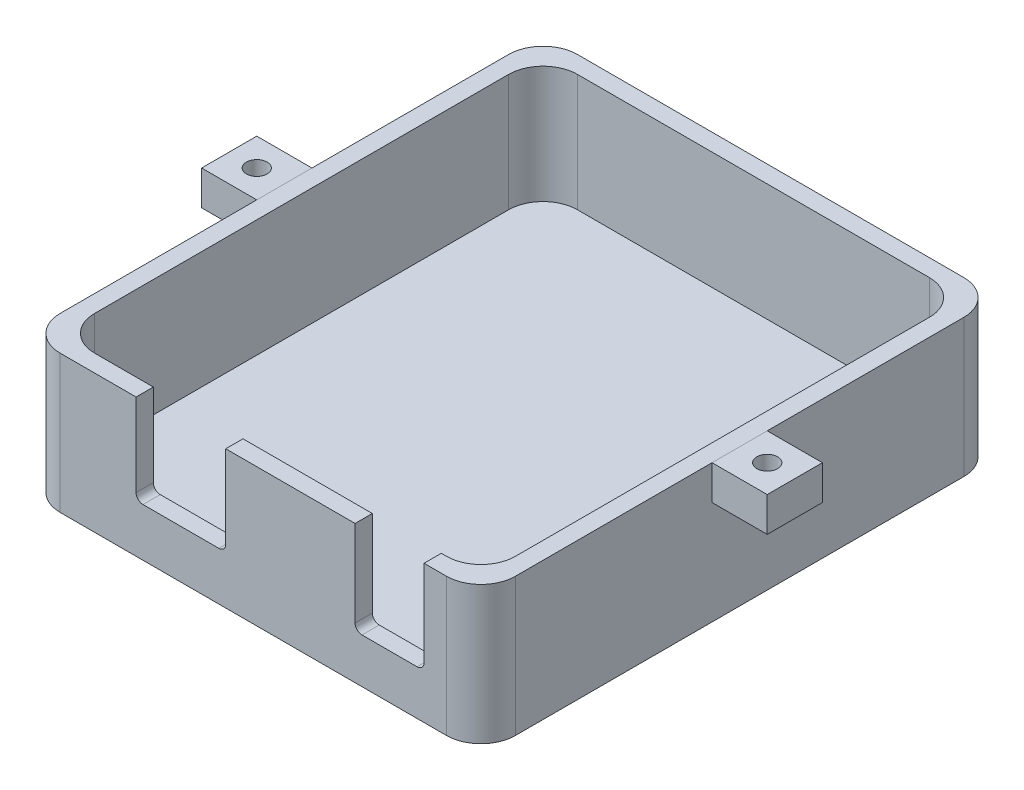
from build123d import *

# Parameters (mm, degrees)
AUFSATZ_LINEAR_AUSTRAGEN1_DEPTH   = 20
SCHNITT_LINEAR_AUSTRAGEN1_DEPTH   = 17
SCHNITT_LINEAR_AUSTRAGEN2_DEPTH   = 17
SKIZZE5_W                         = 8
SKIZZE5_H                         = 8
AUFSATZ_LINEAR_AUSTRAGEN2_DEPTH   = 5
AUFSATZ_LINEAR_AUSTRAGEN2_2_DEPTH = 5
SKIZZE6_R                         = 1.5
SCHNITT_LINEAR_AUSTRAGEN3_DEPTH   = 10


with BuildPart() as part:
    # Skizze1 → Aufsatz-Linear austragen1 (new body)
    with BuildSketch(Plane(origin=(0, 0, 0), x_dir=(1, 0, 0), z_dir=(0, 1, 0))):
        with BuildLine():
            Line((28, -37.5), (-28, -37.5))
            ThreePointArc((-28, -37.5), (-31.535533906, -36.035533906), (-33, -32.5))
            Line((-33, -32.5), (-33, 32.5))
            ThreePointArc((-33, 32.5), (-31.535533906, 36.035533906), (-28, 37.5))
            Line((-28, 37.5), (28, 37.5))
            ThreePointArc((28, 37.5), (31.535533906, 36.035533906), (33, 32.5))
            Line((33, 32.5), (33, -32.5))
            ThreePointArc((33, -32.5), (31.535533906, -36.035533906), (28, -37.5))
        make_face()
    extrude(amount=AUFSATZ_LINEAR_AUSTRAGEN1_DEPTH)

    # Skizze2 → Schnitt-Linear austragen1 (cut)
    with BuildSketch(Plane(origin=(0, 20, 0), x_dir=(1, 0, 0), z_dir=(0, 1, 0))):
        with BuildLine():
            Line((-25.5, 35), (25.5, 35))
            ThreePointArc((25.5, 35), (29.035533906, 33.535533906), (30.5, 30))
            Line((30.5, 30), (30.5, -30))
            ThreePointArc((30.5, -30), (29.035533906, -33.535533906), (25.5, -35))
            Line((25.5, -35), (-25.5, -35))
            ThreePointArc((-25.5, -35), (-29.035533906, -33.535533906), (-30.5, -30))
            Line((-30.5, -30), (-30.5, 30))
            ThreePointArc((-30.5, 30), (-29.035533906, 33.535533906), (-25.5, 35))
        make_face()
    extrude(amount=-SCHNITT_LINEAR_AUSTRAGEN1_DEPTH, mode=Mode.SUBTRACT)

    # Skizze4 → Schnitt-Linear austragen2 (cut)
    with BuildSketch(Plane.XY.offset(37.5)):
        with BuildLine():
            Line((-16, 22), (-5, 22))
            ThreePointArc((-5, 22), (-4.292893219, 21.707106781), (-4, 21))
            Line((-4, 21), (-4, 8))
            ThreePointArc((-4, 8), (-4.292893219, 7.292893219), (-5, 7))
            Line((-5, 7), (-16, 7))
            ThreePointArc((-16, 7), (-16.707106781, 7.292893219), (-17, 8))
            Line((-17, 8), (-17, 21))
            ThreePointArc((-17, 21), (-16.707106781, 21.707106781), (-16, 22))
        make_face()
        with BuildLine():
            Line((15.75, 21.5), (23.75, 21.5))
            ThreePointArc((23.75, 21.5), (24.457106781, 21.207106781), (24.75, 20.5))
            Line((24.75, 20.5), (24.75, 7.5))
            ThreePointArc((24.75, 7.5), (24.457106781, 6.792893219), (23.75, 6.5))
            Line((23.75, 6.5), (15.75, 6.5))
            ThreePointArc((15.75, 6.5), (15.042893219, 6.792893219), (14.75, 7.5))
            Line((14.75, 7.5), (14.75, 20.5))
            ThreePointArc((14.75, 20.5), (15.042893219, 21.207106781), (15.75, 21.5))
        make_face()
    extrude(amount=-SCHNITT_LINEAR_AUSTRAGEN2_DEPTH, mode=Mode.SUBTRACT)


with BuildPart() as body_2:
    # Skizze5 → Aufsatz-Linear austragen2 (new body)
    with BuildSketch(Plane(origin=(0, 20, 0), x_dir=(1, 0, 0), z_dir=(0, 1, 0))):
        with Locations((37, 0)):
            Rectangle(SKIZZE5_W, SKIZZE5_H)
    extrude(amount=-AUFSATZ_LINEAR_AUSTRAGEN2_DEPTH)


with BuildPart() as body_3:
    # Skizze5 → Aufsatz-Linear austragen2 2 (new body)
    with BuildSketch(Plane(origin=(0, 20, 0), x_dir=(1, 0, 0), z_dir=(0, 1, 0))):
        with Locations((-37, 0)):
            Rectangle(SKIZZE5_W, SKIZZE5_H)
    extrude(amount=-AUFSATZ_LINEAR_AUSTRAGEN2_2_DEPTH)


with BuildPart() as schnitt_linear_austragen3_tool:
    # Skizze6 → Schnitt-Linear austragen3 (new body)
    with BuildSketch(Plane(origin=(0, 20, 0), x_dir=(1, 0, 0), z_dir=(0, 1, 0))):
        with Locations(Location((-37, 0, 0), (0, 0, 270))):
            Circle(SKIZZE6_R)
        with Locations(Location((37, 0, 0), (0, 0, 270))):
            Circle(SKIZZE6_R)
    extrude(amount=-SCHNITT_LINEAR_AUSTRAGEN3_DEPTH)


with BuildPart() as body_2_1:
    add(body_2.part)

    # Schnitt-Linear austragen3: cut by schnitt_linear_austragen3_tool
    add(schnitt_linear_austragen3_tool.part, mode=Mode.SUBTRACT)


with BuildPart() as body_3_1:
    add(body_3.part)

    # Schnitt-Linear austragen3: cut by schnitt_linear_austragen3_tool
    add(schnitt_linear_austragen3_tool.part, mode=Mode.SUBTRACT)


solid = Compound([part.part, body_2_1.part, body_3_1.part])
